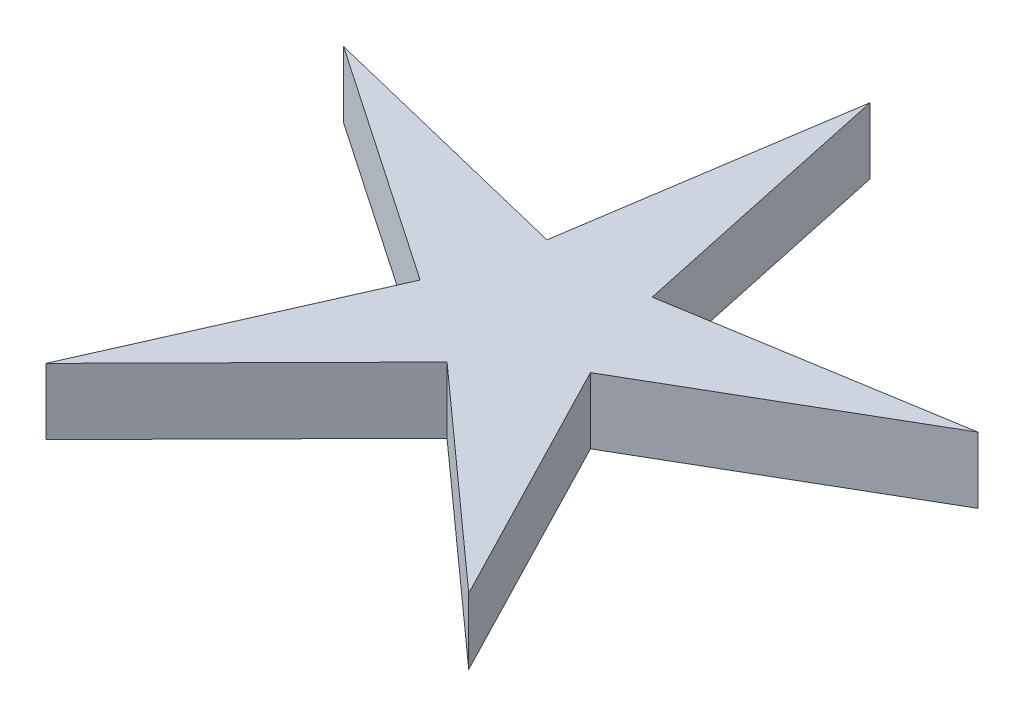
from build123d import *

# Parameters (mm, degrees)
EXTRUDE_1_DEPTH = 10


with BuildPart() as part:
    # 草图1 → 凸台-拉伸1 (new body)
    with BuildSketch(Plane(origin=(0, 0, 0), x_dir=(1, 0, 0), z_dir=(0, 1, 0))):
        Polygon((32.533046209, 63.896470419), (26.0610173, 21.437227307), (-14.699087368, 31.399813008), (21.71975903, 6.573630489), (4.321458755, -32.694341593), (34.514357056, -2.148255491), (66.484047328, -30.829493048), (46.763111779, 7.324919343), (83.919767251, 28.866911776), (41.538660491, 21.901549354), align=None)
    extrude(amount=EXTRUDE_1_DEPTH)


solid = part.part
